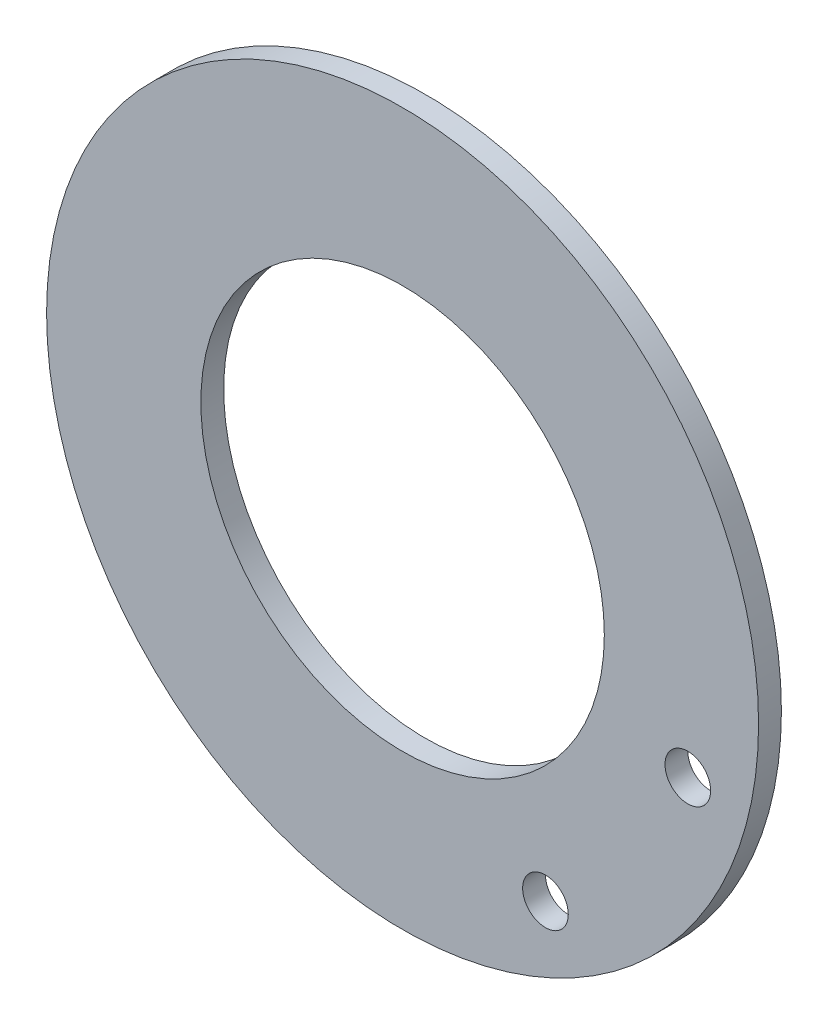
from build123d import *

# Parameters (mm, degrees)
SKETCH1_R           = 49.53
SKETCH1_R_2         = 28.067
BOSS_EXTRUDE1_DEPTH = 3.175
SKETCH2_R           = 3.175
CUT_EXTRUDE1_DEPTH  = 22.86


with BuildPart() as part:
    # Sketch1 → Boss-Extrude1 (new body)
    with BuildSketch(Plane.XY):
        Circle(SKETCH1_R)
        Circle(SKETCH1_R_2, mode=Mode.SUBTRACT)
    extrude(amount=BOSS_EXTRUDE1_DEPTH)

    # Sketch2 → Cut-Extrude1 (cut)
    with BuildSketch(Plane(origin=(182.011125234, -492.106103264, 3.175), x_dir=(0.6237862645633958, 0.7815949693684352, 0), z_dir=(0, 0, 1))):
        with Locations(Location((255.216614788, 411.128007776, 0), (0, 0, 308.593157846))):
            Circle(SKETCH2_R)
        with Locations(Location((286.966614788, 411.128007776, 0), (0, 0, 308.593157846))):
            Circle(SKETCH2_R)
    extrude(amount=-CUT_EXTRUDE1_DEPTH, mode=Mode.SUBTRACT)


solid = part.part
